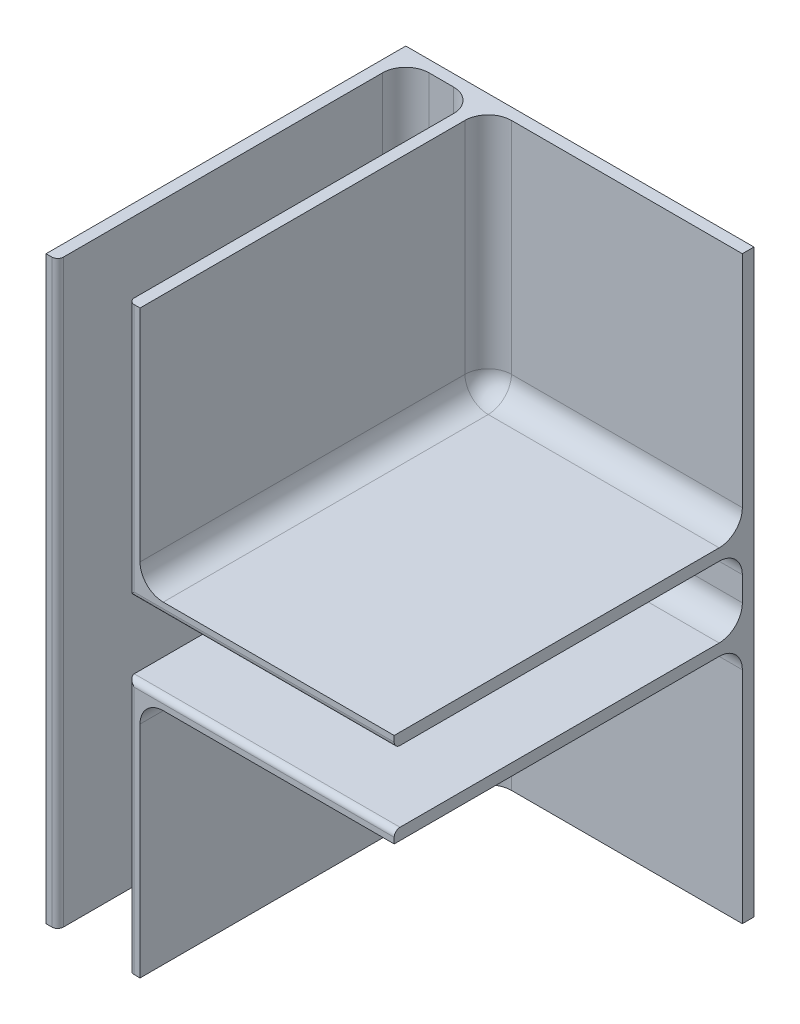
from build123d import *

# Parameters (mm, degrees)
SKETCH1_W           = 30
SKETCH1_H           = 50
BOSS_EXTRUDE1_DEPTH = 1
SKETCH2_W           = 1
SKETCH2_H           = 50
BOSS_EXTRUDE2_DEPTH = 30
FILLET4_R           = 2
FILLET5_R           = 0.5


with BuildPart() as part:
    # Sketch1 → Boss-Extrude1 (new body)
    with BuildSketch(Plane.XY):
        with Locations((15, 25)):
            Rectangle(SKETCH1_W, SKETCH1_H)
    extrude(amount=BOSS_EXTRUDE1_DEPTH)

    # Sketch2 → Boss-Extrude2 (add)
    with BuildSketch(Plane.XY.offset(1)):
        Polygon((7.1, 0), (8.1, 0), (8.1, 20.95), (30, 20.95), (30, 21.95), (8.1, 21.95), (7.1, 21.95), align=None)
        with Locations((0.5, 25)):
            Rectangle(SKETCH2_W, SKETCH2_H)
        Polygon((7.1, 50), (8.1, 50), (8.1, 29.05), (30, 29.05), (30, 28.05), (8.1, 28.05), (7.1, 28.05), align=None)
    extrude(amount=BOSS_EXTRUDE2_DEPTH)

    # Fillet4
    fillet4_edges = [part.edges().sort_by_distance(p)[0] for p in [
        (1, 25, 1),
        (7.1, 10.975, 1),
        (8.1, 10.475, 1),
        (19.05, 20.95, 1),
        (8.1, 20.95, 16),
        (18.55, 21.95, 1),
        (7.1, 39.025, 1),
        (18.55, 28.05, 1),
        (19.05, 29.05, 1),
        (8.1, 39.525, 1),
        (8.1, 29.05, 16),
    ]]
    fillet(fillet4_edges, radius=FILLET4_R)

    # Fillet5
    fillet5_edges = [part.edges().sort_by_distance(p)[0] for p in [
        (1, 25, 31),
        (7.1, 10.975, 31),
        (18.55, 21.95, 31),
        (7.1, 39.025, 31),
        (18.55, 28.05, 31),
    ]]
    fillet(fillet5_edges, radius=FILLET5_R)


solid = part.part
